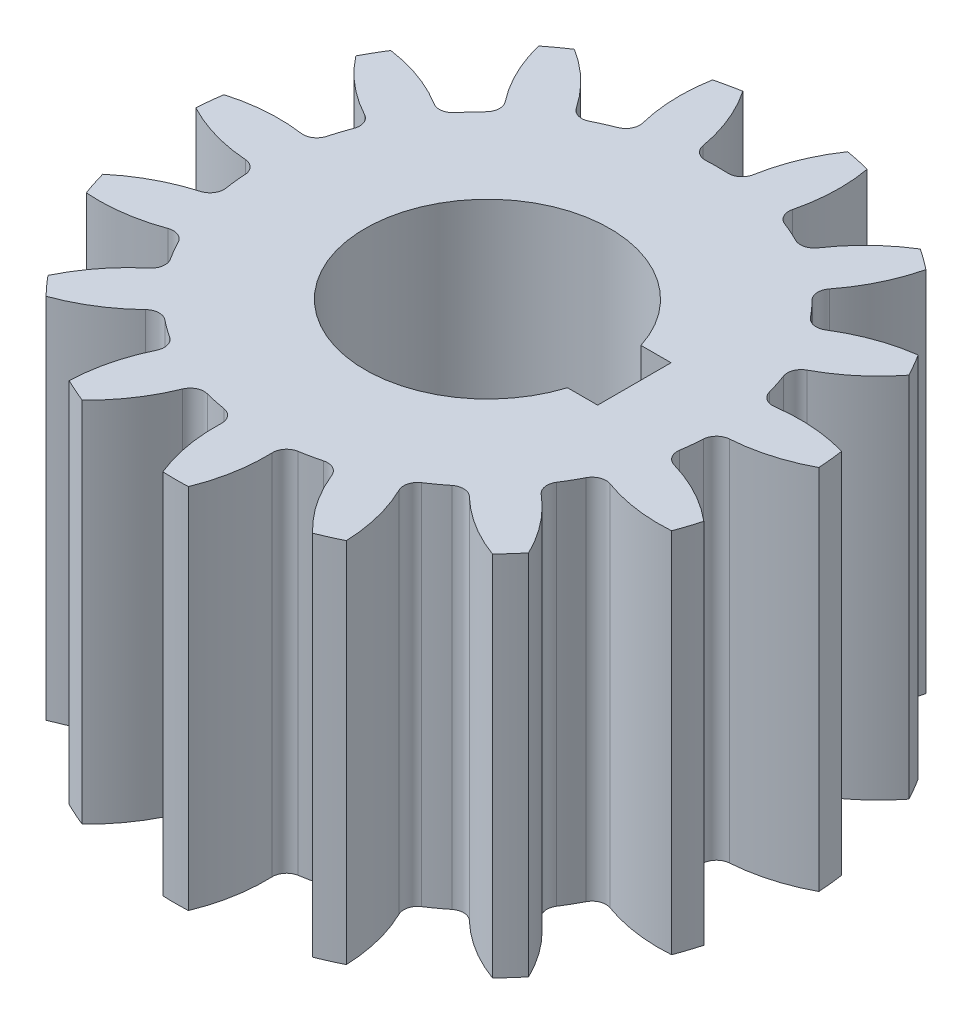
from build123d import *

# Parameters (mm, degrees)
SKETCH1_R                = 12.75
SKETCH1_R_2              = 5
BOSS_EXTRUDE1_DEPTH      = 15
CUT_EXTRUDE1_DEPTH       = 15
FILLET1_R                = 0.57
CIRPATTERN1_COUNT        = 15
FILLET1_OF_CIRPATTERN1_R = 0.57
CUT_EXTRUDE2_REACH       = 25.441
SKETCH3_W                = 6
SKETCH3_H                = 3
SCALE1_SCALE             = 10


with BuildPart() as part:
    # Sketch1 → Boss-Extrude1 (new body)
    with BuildSketch(Plane(origin=(0, 0, 0), x_dir=(1, 0, 0), z_dir=(0, 1, 0))):
        with Locations(Location((0, 0, 0), (0, 0, 270))):
            Circle(SKETCH1_R)
        with Locations(Location((0, 0, 0), (0, 0, 270))):
            Circle(SKETCH1_R_2, mode=Mode.SUBTRACT)
    extrude(amount=BOSS_EXTRUDE1_DEPTH)

    # Sketch2 → Cut-Extrude1 (cut)
    with BuildSketch(Plane(origin=(0, 0, 0), x_dir=(1, 0, 0), z_dir=(0, 1, 0))):
        with BuildLine():
            ThreePointArc((0.957065684, 9.326020066), (0, 9.375), (-0.957065684, 9.326020066))
            ThreePointArc((-0.957065684, 9.326020066), (-1.346189301, 11.020987647), (-2.137607477, 12.569531983))
            ThreePointArc((-2.137607477, 12.569531983), (0, 12.75), (2.137607477, 12.569531983))
            ThreePointArc((2.137607477, 12.569531983), (1.346189301, 11.020987647), (0.957065684, 9.326020066))
        make_face()
    cut_extrude1 = extrude(amount=CUT_EXTRUDE1_DEPTH, mode=Mode.SUBTRACT)

    # Fillet1
    fillet1_edges = [part.edges().sort_by_distance(p)[0] for p in [
        (0.957065684, 7.5, -9.326020066),
        (-0.957065684, 7.5, -9.326020066),
    ]]
    fillet(fillet1_edges, radius=FILLET1_R)

    # CirPattern1: Cut-Extrude1 ×15 about axis
    cirpattern1_axis = Axis((0, 0, 0), (0, 1, 0))
    for i in range(1, CIRPATTERN1_COUNT):
        add(cut_extrude1.rotate(cirpattern1_axis, i * 360 / CIRPATTERN1_COUNT), mode=Mode.SUBTRACT)

    # Fillet1 of CirPattern1
    fillet1_of_cirpattern1_edges = [part.edges().sort_by_distance(p)[0] for p in [
        (-2.918911086, 7.5, -8.909016953),
        (-4.667557104, 7.5, -8.130469586),
        (-6.290181613, 7.5, -6.951563873),
        (-7.570985496, 7.5, -5.529087051),
        (-8.573822594, 7.5, -3.792122246),
        (-9.165321716, 7.5, -1.971675135),
        (-9.374971758, 7.5, 0.023011768),
        (-9.174890547, 7.5, 1.926657324),
        (-8.555103136, 7.5, 3.834166837),
        (-7.598037451, 7.5, 5.491853229),
        (-6.255979461, 7.5, 6.982359629),
        (-4.707414654, 7.5, 8.107457818),
        (-2.875140103, 7.5, 8.923239008),
        (-1.002837098, 7.5, 9.321209297),
        (1.002837098, 7.5, 9.321209297),
        (2.875140103, 7.5, 8.923239008),
        (4.707414654, 7.5, 8.107457818),
        (6.255979461, 7.5, 6.982359629),
        (7.598037451, 7.5, 5.491853229),
        (8.555103136, 7.5, 3.834166837),
        (9.174890547, 7.5, 1.926657324),
        (9.374971758, 7.5, 0.023011768),
        (9.165321716, 7.5, -1.971675135),
        (8.573822594, 7.5, -3.792122246),
        (7.570985496, 7.5, -5.529087051),
        (6.290181613, 7.5, -6.951563873),
        (4.667557104, 7.5, -8.130469586),
        (2.918911086, 7.5, -8.909016953),
    ]]
    fillet(fillet1_of_cirpattern1_edges, radius=FILLET1_OF_CIRPATTERN1_R)

    # Sketch3 → Cut-Extrude2 (cut, up to next)
    with BuildSketch(Plane(origin=(0, 15, 0), x_dir=(1, 0, 0), z_dir=(0, 1, 0)), mode=Mode.PRIVATE) as cut_extrude2_sk1:
        with Locations((3, 0)):
            Rectangle(SKETCH3_W, SKETCH3_H)
    cut_extrude2_tool1 = extrude(cut_extrude2_sk1.sketch, amount=-CUT_EXTRUDE2_REACH, mode=Mode.PRIVATE) & part.part
    add(cut_extrude2_tool1.solids().sort_by_distance((3, 15, 0))[0], mode=Mode.SUBTRACT)


with BuildPart() as part_1:
    # Scale1: scaled about (-0.061174232, 7.5, 0)
    add(part.part.scale(SCALE1_SCALE).moved(Location((0.550568088, -67.5, 0))))


solid = part_1.part
